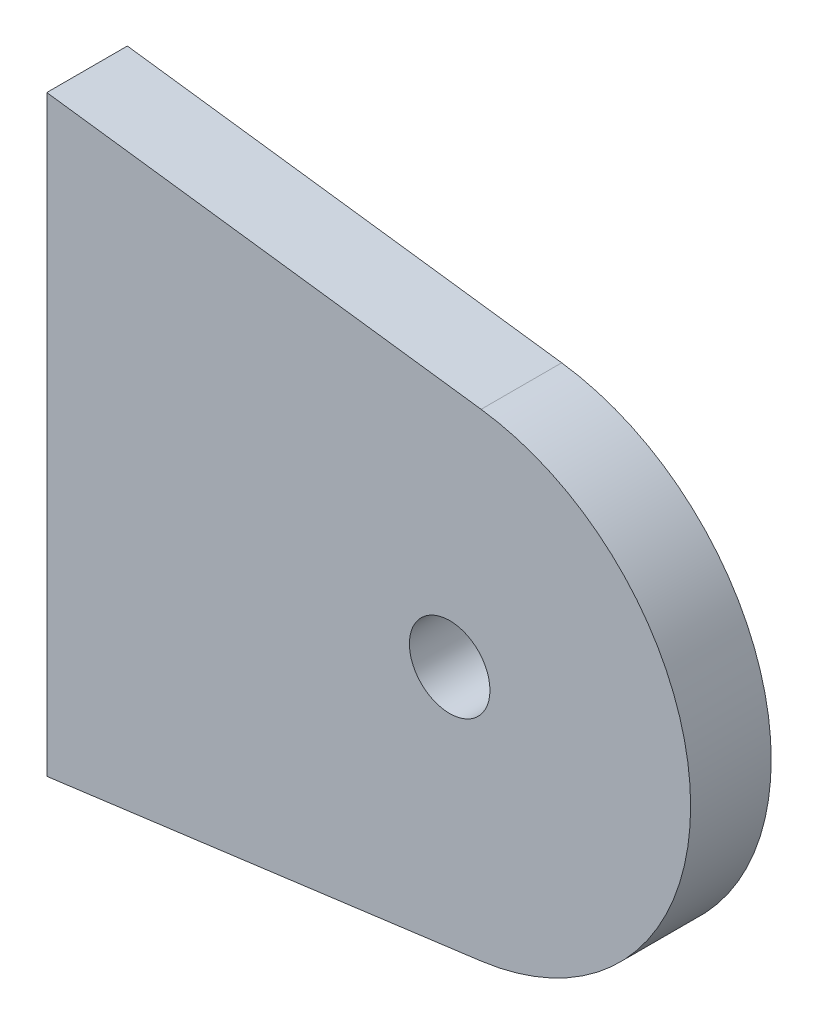
from build123d import *

# Parameters (mm, degrees)
SKETCH1_R           = 1.5875
BOSS_EXTRUDE1_DEPTH = 3.175


with BuildPart() as part:
    # Sketch1 → Boss-Extrude1 (new body)
    with BuildSketch(Plane(origin=(-1053.740804459, 0, 0), x_dir=(1, 0, 0), z_dir=(0, 0, 1))):
        with BuildLine():
            Line((1037.865804459, -11.667855634), (1054.980272331, -9.414693193))
            ThreePointArc((1054.980272331, -9.414693193), (1063.236736668, 0), (1054.980272331, 9.414693193))
            Line((1054.980272331, 9.414693193), (1037.865804459, 11.667855634))
            Line((1037.865804459, 11.667855634), (1037.865804459, -11.667855634))
        make_face()
        with Locations((1053.740804459, 0)):
            Circle(SKETCH1_R, mode=Mode.SUBTRACT)
    extrude(amount=BOSS_EXTRUDE1_DEPTH)


solid = part.part
